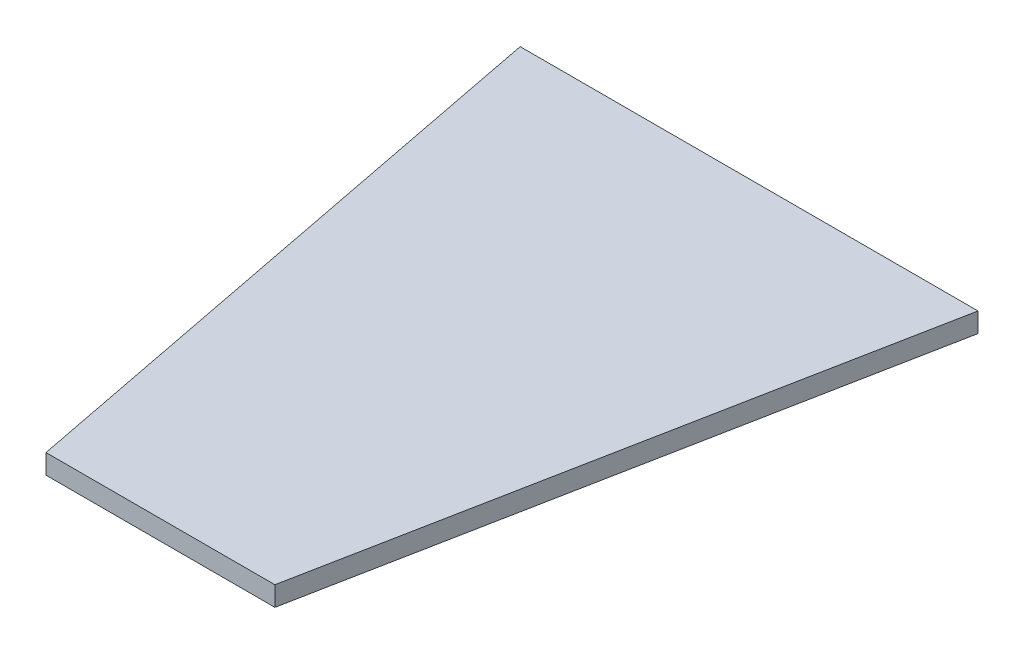
from build123d import *

# Parameters (mm, degrees)
BOSS_EXTRUDE1_DEPTH = 3


with BuildPart() as part:
    # Sketch1 → Boss-Extrude1 (new body)
    with BuildSketch(Plane(origin=(0, 0, 0), x_dir=(1, 0, 0), z_dir=(0, 1, 0))):
        Polygon((-31.23655914, 18.72311828), (38.76344086, 18.72311828), (21.26344086, -71.27688172), (-13.73655914, -71.27688172), align=None)
    extrude(amount=BOSS_EXTRUDE1_DEPTH)


solid = part.part
